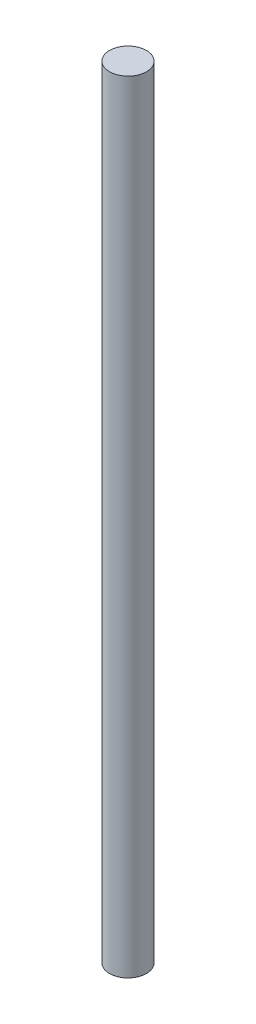
from build123d import *

# Parameters (mm, degrees)
SKETCH1_R           = 2.6
BOSS_EXTRUDE1_DEPTH = 110


with BuildPart() as part:
    # Sketch1 → Boss-Extrude1 (new body)
    with BuildSketch(Plane(origin=(0, 0, 0), x_dir=(1, 0, 0), z_dir=(0, 1, 0))):
        with Locations(Location((0, 0, 0), (0, 0, 270))):
            Circle(SKETCH1_R)
    extrude(amount=BOSS_EXTRUDE1_DEPTH)


solid = part.part
